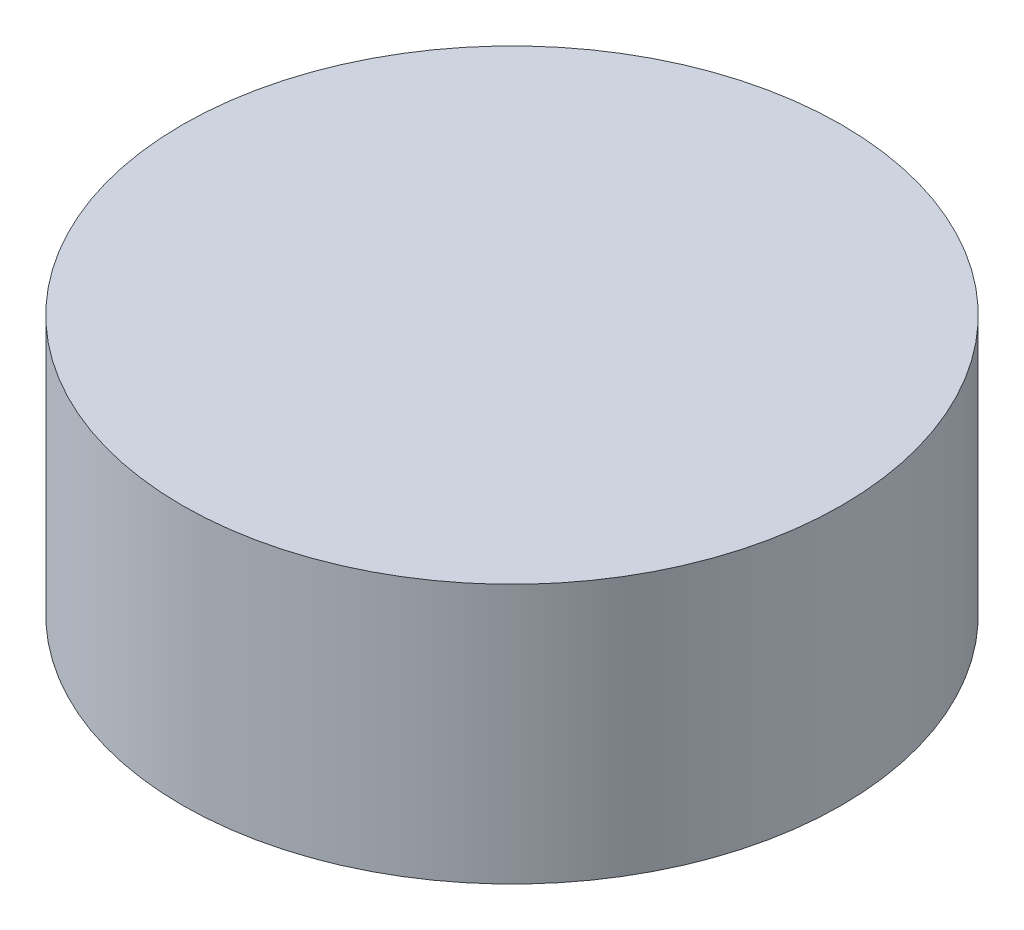
from build123d import *

# Parameters (mm, degrees)
SKETCH1_R                     = 6.35
BOSS_EXTRUDE1_DEPTH           = 5
TAP_DRILL_FOR_4_40_TAP1_D     = 2.2606
TAP_DRILL_FOR_4_40_TAP1_DEPTH = 2.286
TAP_DRILL_FOR_4_40_TAP1_TIP   = 0.679152758


with BuildPart() as part:
    # Sketch1 → Boss-Extrude1 (new body)
    with BuildSketch(Plane(origin=(0, 0, 0), x_dir=(1, 0, 0), z_dir=(0, 1, 0))):
        with Locations(Location((0, 0, 0), (0, 0, 270))):
            Circle(SKETCH1_R)
    extrude(amount=BOSS_EXTRUDE1_DEPTH)

    # Tap Drill for #4-40 Tap1
    with Locations(Plane(origin=(0, 0, 0), x_dir=(-1, 0, 0), z_dir=(0, -1, 0))):
        with Locations((0, 0)):
            Hole(TAP_DRILL_FOR_4_40_TAP1_D / 2, depth=TAP_DRILL_FOR_4_40_TAP1_DEPTH)
            with Locations((0, 0, -(TAP_DRILL_FOR_4_40_TAP1_DEPTH + TAP_DRILL_FOR_4_40_TAP1_TIP / 2))):  # 118° drill point
                Cone(0, TAP_DRILL_FOR_4_40_TAP1_D / 2, TAP_DRILL_FOR_4_40_TAP1_TIP, mode=Mode.SUBTRACT)


solid = part.part
